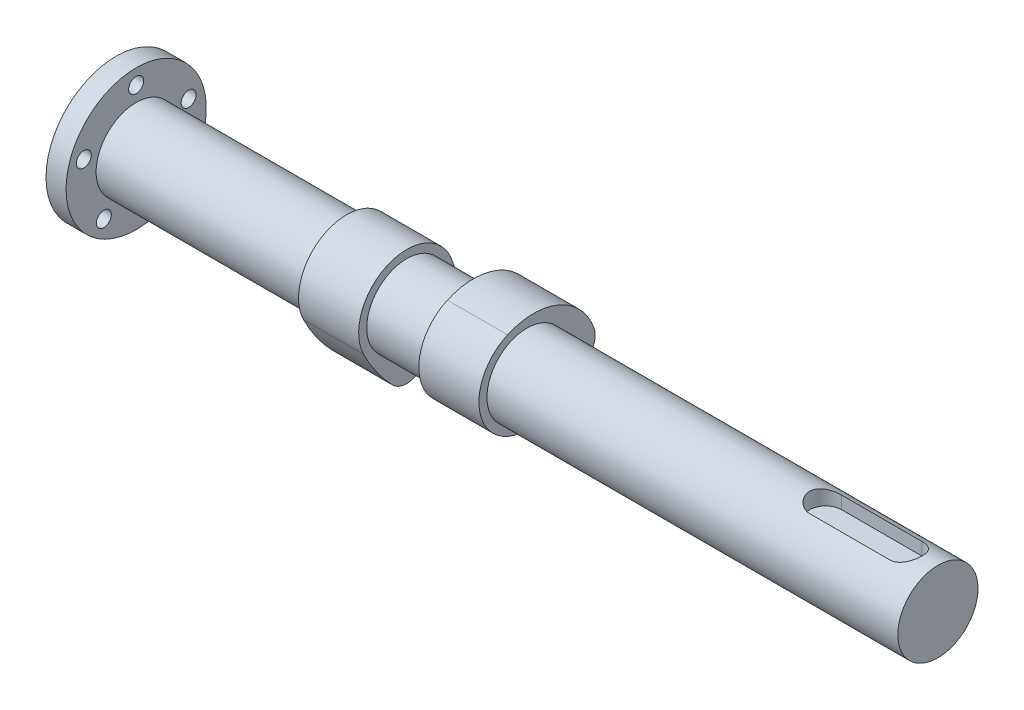
from build123d import *

# Parameters (mm, degrees)
BOSS_EXTRUDE1_DEPTH      = 500
BOSS_EXTRUDE1_DEPTH_BACK = 300
SKETCH1_R                = 40
BOSS_EXTRUDE2_START      = 60
BOSS_EXTRUDE2_DEPTH      = 30
BODY_MOVE_COPY1_ANGLE    = 90
CUT_EXTRUDE1_DEPTH       = 16
SKETCH5_R                = 70
BOSS_EXTRUDE3_DEPTH      = 20
SKETCH6_R                = 7.5
CUT_EXTRUDE2_DEPTH       = 20
CIRPATTERN1_COUNT        = 5


with BuildPart() as part:
    # Sketch1 → Boss-Extrude1 (new, two sides: drawn at the far end of the back side and taken through both)
    with BuildSketch(Plane(origin=(0, 0, 0), x_dir=(0, 0, -1), z_dir=(1, 0, 0)).offset(-BOSS_EXTRUDE1_DEPTH_BACK)):
        Circle(SKETCH1_R)
    extrude(amount=BOSS_EXTRUDE1_DEPTH + BOSS_EXTRUDE1_DEPTH_BACK)

    # Sketch4 → Cut-Extrude1 (cut)
    with BuildSketch(Plane(origin=(0, 40, 0), x_dir=(1, 0, 0), z_dir=(0, 1, 0))):
        with BuildLine():
            Line((388, 16), (468, 16))
            ThreePointArc((468, 16), (484, 0), (468, -16))
            Line((468, -16), (388, -16))
            ThreePointArc((388, -16), (372, 0), (388, 16))
        make_face()
    extrude(amount=-CUT_EXTRUDE1_DEPTH, mode=Mode.SUBTRACT)

    # Sketch5 → Boss-Extrude3 (add)
    with BuildSketch(Plane.ZY.offset(300)):
        Circle(SKETCH5_R)
    extrude(amount=BOSS_EXTRUDE3_DEPTH)

    # Sketch6 → Cut-Extrude2 (cut)
    with BuildSketch(Plane.ZY.offset(320)):
        with Locations((0, 55)):
            Circle(SKETCH6_R)
    cut_extrude2 = extrude(amount=-CUT_EXTRUDE2_DEPTH, mode=Mode.SUBTRACT)

    # CirPattern1: Cut-Extrude2 ×5 about axis
    cirpattern1_axis = Axis((0, 0, 0), (1, 0, 0))
    for i in range(1, CIRPATTERN1_COUNT):
        add(cut_extrude2.rotate(cirpattern1_axis, i * 360 / CIRPATTERN1_COUNT), mode=Mode.SUBTRACT)


with BuildPart() as body_2:
    # Sketch2 → Boss-Extrude2 (new, symmetric)
    with BuildSketch(Plane(origin=(0, 0, 0), x_dir=(0, 0, -1), z_dir=(1, 0, 0)).offset(BOSS_EXTRUDE2_START)):
        with BuildLine():
            ThreePointArc((-19.468358274, 43.874628501), (-43.472353382, -20.350786015), (21.224906467, -43.052332637))
            ThreePointArc((21.224906467, -43.052332637), (42.694979911, -30.29437767), (61.918171208, -14.350777546))
            ThreePointArc((61.918171208, -14.350777546), (67.457858752, -4.573499044), (66.850688147, 6.647670985))
            ThreePointArc((66.850688147, 6.647670985), (31.834284447, 44.142797827), (-19.468358274, 43.874628501))
        make_face()
    extrude(amount=BOSS_EXTRUDE2_DEPTH, both=True)


with BuildPart() as body_3:
    # Mirror3: mirrored copy
    add(body_2.part.mirror(Plane(origin=(0, 0, 0), x_dir=(0, 0, 1), z_dir=(1, 0, 0))))


with BuildPart() as body_3_1:
    # Body-Move/Copy1: moved
    add(body_3.part.rotate(Axis((0, 0, 0), (-1, 0, 0)), BODY_MOVE_COPY1_ANGLE))


solid = Compound([part.part, body_2.part, body_3_1.part])
